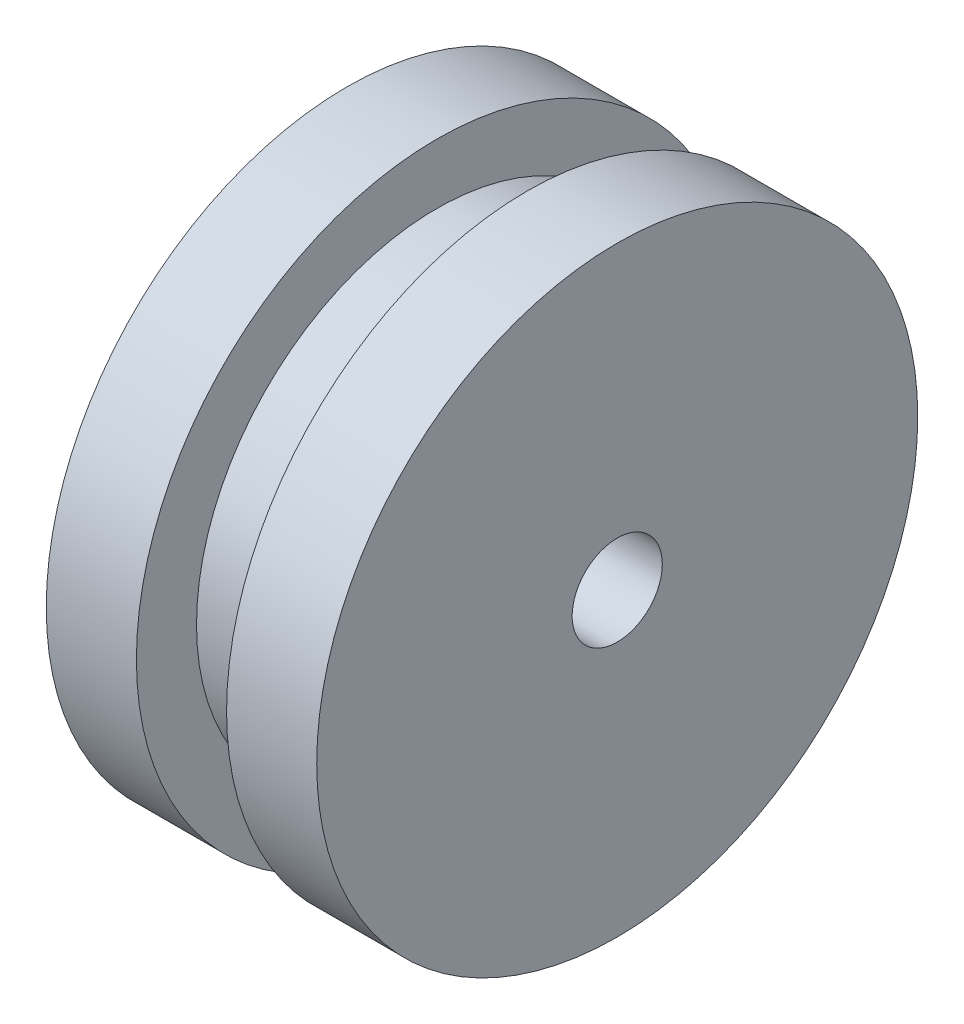
from build123d import *

# Parameters (mm, degrees)
SKETCH3_R           = 15.875
BOSS_EXTRUDE1_DEPTH = 4.7625
SKETCH5_R           = 12.7
BOSS_EXTRUDE2_DEPTH = 4.7625
SKETCH6_R           = 15.875
BOSS_EXTRUDE3_DEPTH = 4.7625
SKETCH7_R           = 2.38125
CUT_EXTRUDE1_DEPTH  = 27.6113492


with BuildPart() as part:
    # Sketch3 → Boss-Extrude1 (new body)
    with BuildSketch(Plane(origin=(0, 0, 0), x_dir=(0, 0, -1), z_dir=(1, 0, 0))):
        with Locations(Location((0, 0, 0), (0, 0, 180))):
            Circle(SKETCH3_R)
    extrude(amount=BOSS_EXTRUDE1_DEPTH)


with BuildPart() as body_2:
    # Sketch5 → Boss-Extrude2 (new body)
    with BuildSketch(Plane(origin=(4.7625, 0, 0), x_dir=(0, 0, -1), z_dir=(1, 0, 0))):
        with Locations(Location((0, 0, 0), (0, 0, 180))):
            Circle(SKETCH5_R)
    extrude(amount=BOSS_EXTRUDE2_DEPTH)


with BuildPart() as body_3:
    # Sketch6 → Boss-Extrude3 (new body)
    with BuildSketch(Plane(origin=(9.525, 0, 0), x_dir=(0, 0, -1), z_dir=(1, 0, 0))):
        with Locations(Location((0, 0, 0), (0, 0, 180))):
            Circle(SKETCH6_R)
    extrude(amount=BOSS_EXTRUDE3_DEPTH)


with BuildPart() as cut_extrude1_tool:
    # Sketch7 → Cut-Extrude1 (new, through all)
    with BuildSketch(Plane(origin=(14.2875, 0, 0), x_dir=(0, 0, -1), z_dir=(1, 0, 0))):
        Circle(SKETCH7_R)
    extrude(amount=-CUT_EXTRUDE1_DEPTH)


with BuildPart() as part_1:
    add(part.part)

    # Cut-Extrude1: cut by cut_extrude1_tool
    add(cut_extrude1_tool.part, mode=Mode.SUBTRACT)


with BuildPart() as body_2_1:
    add(body_2.part)

    # Cut-Extrude1: cut by cut_extrude1_tool
    add(cut_extrude1_tool.part, mode=Mode.SUBTRACT)


with BuildPart() as body_3_1:
    add(body_3.part)

    # Cut-Extrude1: cut by cut_extrude1_tool
    add(cut_extrude1_tool.part, mode=Mode.SUBTRACT)


solid = Compound([part_1.part, body_2_1.part, body_3_1.part])
